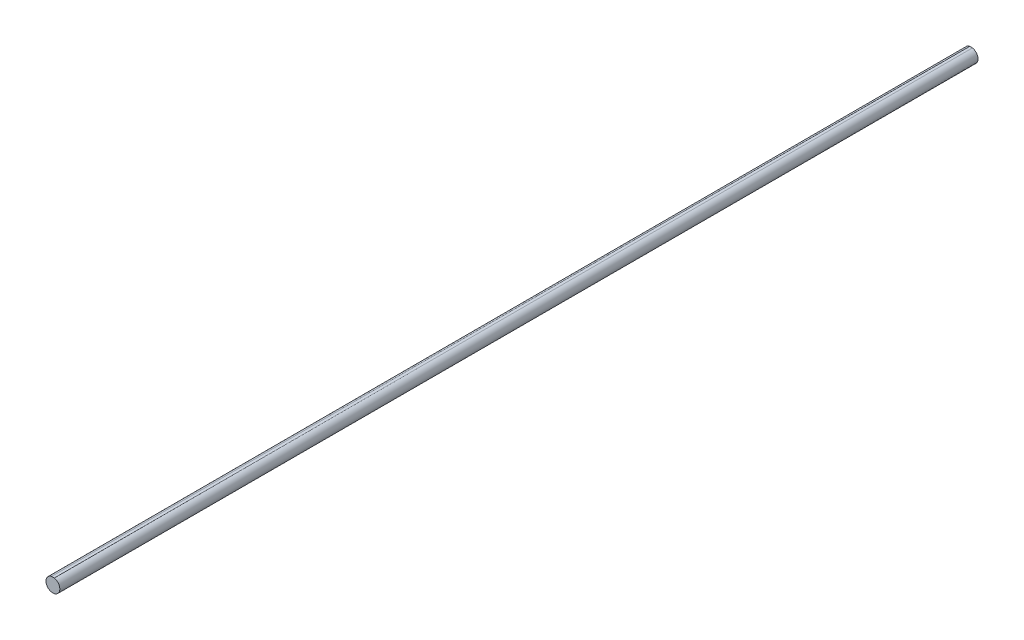
from build123d import *

# Parameters (mm, degrees)
SKETCH_1_R          = 5
EXTRUDE_1_DEPTH     = 665
CUT_EXTRUDE_1_DEPTH = 666.037592922


with BuildPart() as part:
    # Эскиз1 → Бобышка-Вытянуть1 (new body)
    with BuildSketch(Plane.XY):
        Circle(SKETCH_1_R)
    extrude(amount=-EXTRUDE_1_DEPTH)

    # Эскиз2 → Вырез-Вытянуть1 (cut, through all)
    with BuildSketch(Plane.XY):
        with BuildLine():
            Line((0, 5), (0, 4.9))
            Line((0, 4.9), (0.994987437, 4.9))
            ThreePointArc((0.994987437, 4.9), (0.5, 4.974937186), (0, 5))
        make_face()
        with BuildLine():
            Line((-0.994987437, 4.9), (0, 4.9))
            Line((0, 4.9), (0, 5))
            ThreePointArc((0, 5), (-0.5, 4.974937186), (-0.994987437, 4.9))
        make_face()
    extrude(amount=-CUT_EXTRUDE_1_DEPTH, mode=Mode.SUBTRACT)


solid = part.part
